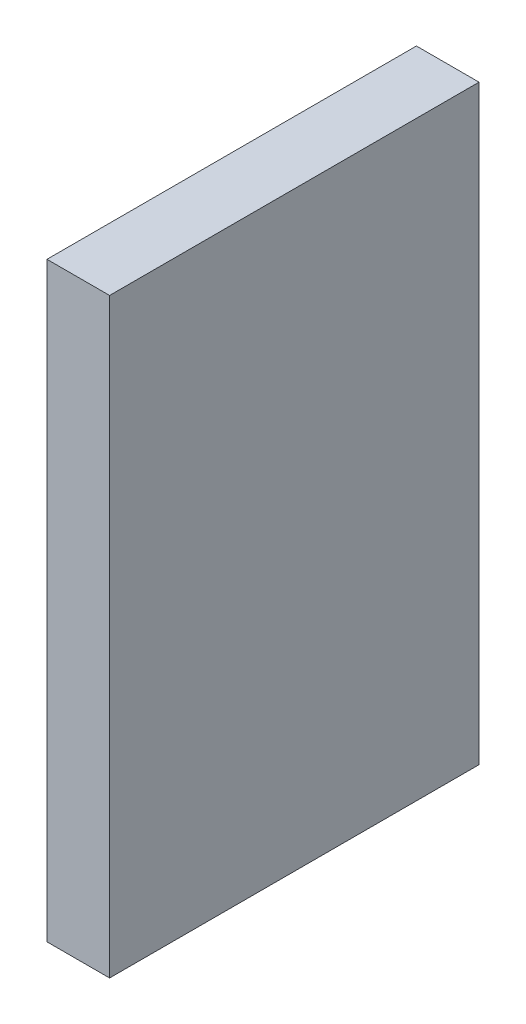
from build123d import *

# Parameters (mm, degrees)
SKETCH2_W           = 63.5
SKETCH2_H           = 374.65
BOSS_EXTRUDE1_DEPTH = 299.72


with BuildPart() as part:
    # Sketch2 → Boss-Extrude1 (new, symmetric)
    with BuildSketch(Plane(origin=(0, 0, 0), x_dir=(1, 0, 0), z_dir=(0, 1, 0))):
        with Locations((0, 12.7)):
            Rectangle(SKETCH2_W, SKETCH2_H)
    extrude(amount=BOSS_EXTRUDE1_DEPTH, both=True)


solid = part.part
